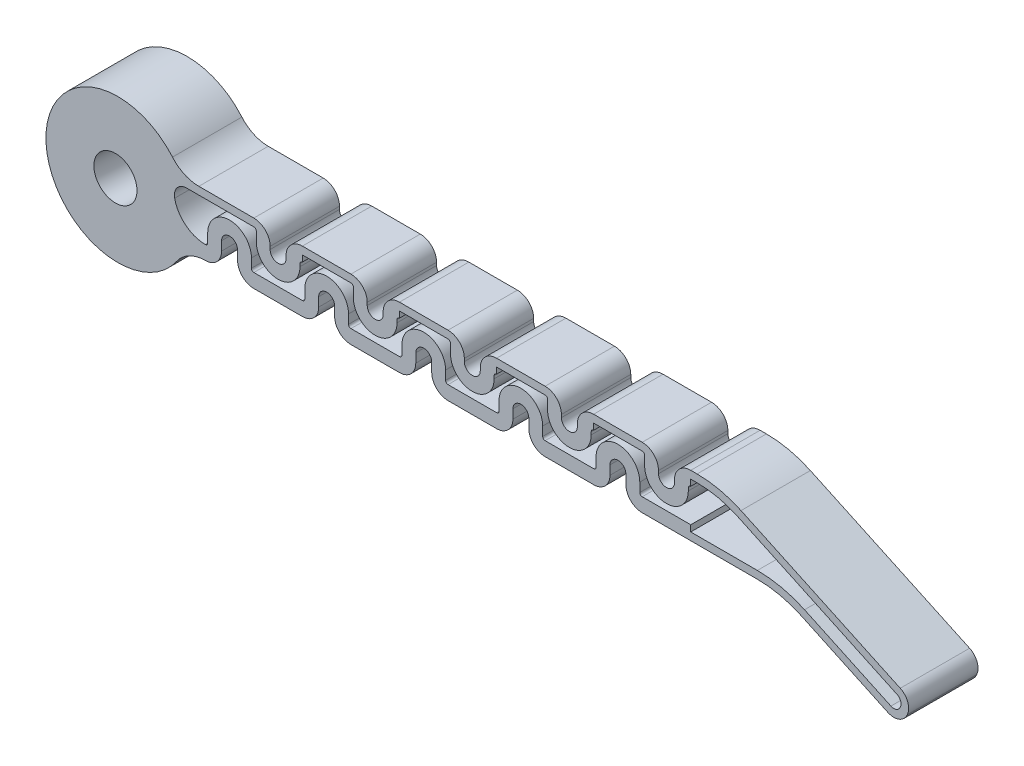
from build123d import *

# Parameters (mm, degrees)
BOSS_EXTRU_1_DEPTH         = 5
CONG_4_R                   = 5
CONG_3_R                   = 15
ENL_V_MAT_EXTRU_5_DEPTH    = 116.769346319
R_P_TITION_LIN_AIRE1_COUNT = 5
R_P_TITION_LIN_AIRE1_PITCH = 14
ENL_V_MAT_EXTRU_6_DEPTH    = 116.769346319
CONG_6_R                   = 2.1


with BuildPart() as part:
    # Esquisse1 → Boss.-Extru.1 (new, symmetric)
    with BuildSketch(Plane.XY):
        with BuildLine():
            Line((9.090688918, 5), (86.842811698, 5))
            Line((86.842811698, 5), (114.721401665, -8))
            Line((114.721401665, -8), (112.90414314, -11.897123484))
            Line((112.90414314, -11.897123484), (95.539805791, -3.8))
            Line((95.539805791, -3.8), (9.654047079, -3.8))
            ThreePointArc((9.654047079, -3.8), (-10.353805189, -0.662829619), (9.090688918, 5))
        make_face()
    extrude(amount=BOSS_EXTRU_1_DEPTH, both=True)

    # Congé4
    cong_4_edges = [part.edges().sort_by_distance(p)[0] for p in [
        (9.654047079, -3.8, 0),
        (9.090688918, 5, 0),
    ]]
    fillet(cong_4_edges, radius=CONG_4_R)

    # Congé3
    cong_3_edges = [part.edges().sort_by_distance(p)[0] for p in [
        (95.539805791, -3.8, 0),
        (86.842811698, 5, 0),
    ]]
    fillet(cong_3_edges, radius=CONG_3_R)

    # Esquisse10 → Enlèvement de matière-Révolution1 (revolve, cut)
    with BuildSketch(Plane(origin=(0, 0, 0), x_dir=(1, 0, 0), z_dir=(0, 1, 0))):
        Polygon((0.697564737, 9.975640503), (-0.697564737, -9.975640503), (2.394883818, -10.191885571), (3.790013293, 9.759395434), align=None)
    revolve(axis=Axis((0.697564737, 0, -9.975640503), (0.06975647374413119, 0, -0.9975640502598239)), mode=Mode.SUBTRACT)

    # Esquisse8 → Enlèv. mat.-Extru.5 (cut, symmetric)
    with BuildSketch(Plane(origin=(0, 0, -5), x_dir=(-1, 0, 0), z_dir=(0, 0, -1))):
        with BuildLine():
            Line((-17.257562182, -0.15), (-17.257562182, -1.450000033))
            ThreePointArc((-17.257562182, -1.450000033), (-17.945861236, -3.111700945), (-19.607562149, -3.8))
            Line((-19.607562149, -3.8), (-12.607562215, -3.8))
            ThreePointArc((-12.607562215, -3.8), (-14.269263127, -3.111700945), (-14.957562182, -1.450000033))
            Line((-14.957562182, -1.450000033), (-14.957562182, -0.15))
            ThreePointArc((-14.957562182, -0.15), (-16.107562182, 1), (-17.257562182, -0.15))
        make_face()
        with BuildLine():
            Line((-19.607562281, 3.9), (-12.607562215, 3.9))
            Line((-12.607562215, 3.9), (-12.607562215, -1.8))
            ThreePointArc((-12.607562215, -1.8), (-12.855049565, -1.697487383), (-12.957562182, -1.450000033))
            Line((-12.957562182, -1.450000033), (-12.957562182, -0.15))
            ThreePointArc((-12.957562182, -0.15), (-16.107562182, 3), (-19.257562182, -0.15))
            Line((-19.257562182, -0.15), (-19.257562182, -1.450000033))
            ThreePointArc((-19.257562182, -1.450000033), (-19.360074845, -1.69748743), (-19.607562281, -1.8))
            Line((-19.607562281, -1.8), (-26.607562215, -1.8))
            Line((-26.607562215, -1.8), (-26.607562215, 3))
            ThreePointArc((-26.607562215, 3), (-26.360074865, 2.897487383), (-26.257562248, 2.650000033))
            Line((-26.257562248, 2.650000033), (-26.257562248, 2.25))
            ThreePointArc((-26.257562248, 2.25), (-23.107562248, -0.9), (-19.957562248, 2.25))
            Line((-19.957562248, 2.25), (-19.957562248, 3.550000033))
            ThreePointArc((-19.957562248, 3.550000033), (-19.855049631, 3.797487383), (-19.607562281, 3.9))
        make_face()
        with BuildLine():
            Line((-26.607562215, 5), (-19.607562281, 5))
            ThreePointArc((-19.607562281, 5), (-21.269263193, 4.311700945), (-21.957562248, 2.650000033))
            Line((-21.957562248, 2.650000033), (-21.957562248, 2.25))
            ThreePointArc((-21.957562248, 2.25), (-23.107562248, 1.1), (-24.257562248, 2.25))
            Line((-24.257562248, 2.25), (-24.257562248, 2.650000033))
            ThreePointArc((-24.257562248, 2.650000033), (-24.945861302, 4.311700945), (-26.607562215, 5))
        make_face()
    enl_v_mat_extru_5 = extrude(amount=ENL_V_MAT_EXTRU_5_DEPTH, both=True, mode=Mode.SUBTRACT)

    # Répétition linéaire1: Enlèv. mat.-Extru.5 ×5
    with Locations(*[(i * R_P_TITION_LIN_AIRE1_PITCH, 0, 0) for i in range(1, R_P_TITION_LIN_AIRE1_COUNT)]):
        add(enl_v_mat_extru_5, mode=Mode.SUBTRACT)

    # Esquisse9 → Enlèv. mat.-Extru.6 (cut, through all)
    with BuildSketch(Plane(origin=(0, 0, -5), x_dir=(-1, 0, 0), z_dir=(0, 0, -1))):
        with BuildLine():
            Line((-12.607562215, 3.9), (-12.607562215, -1.8))
            ThreePointArc((-12.607562215, -1.8), (-9.766736082, -0.796647883), (-8.186194586, 1.768288211))
            ThreePointArc((-8.186194586, 1.768288211), (-8.5369321, 3.245312267), (-9.906603899, 3.9))
            Line((-9.906603899, 3.9), (-12.607562215, 3.9))
        make_face()
        with BuildLine():
            Line((-83.517391759, 3.9), (-82.607562215, 3.9))
            Line((-82.607562215, 3.9), (-82.607562215, -2.7))
            Line((-82.607562215, -2.7), (-92.214385852, -2.7))
            ThreePointArc((-92.214385852, -2.7), (-95.699063636, -3.081634285), (-99.018539866, -4.208444629))
            Line((-99.018539866, -4.208444629), (-111.465776875, -10.012686569))
            ThreePointArc((-111.465776875, -10.012686569), (-112.23041528, -10.046071403), (-112.794702924, -9.528997044))
            Line((-112.794702924, -9.528997044), (-112.83696475, -9.438366265))
            ThreePointArc((-112.83696475, -9.438366265), (-112.870349583, -8.67372786), (-112.353275224, -8.109440216))
            Line((-112.353275224, -8.109440216), (-89.391785597, 2.59767824))
            ThreePointArc((-89.391785597, 2.59767824), (-86.525902393, 3.570514499), (-83.517391759, 3.9))
        make_face()
    extrude(amount=-ENL_V_MAT_EXTRU_6_DEPTH, mode=Mode.SUBTRACT)

    # Congé6
    cong_6_edges = [part.edges().sort_by_distance(p)[0] for p in [
        (114.721401665, -8, 0),
        (112.90414314, -11.897123484, 0),
    ]]
    fillet(cong_6_edges, radius=CONG_6_R)


solid = part.part
